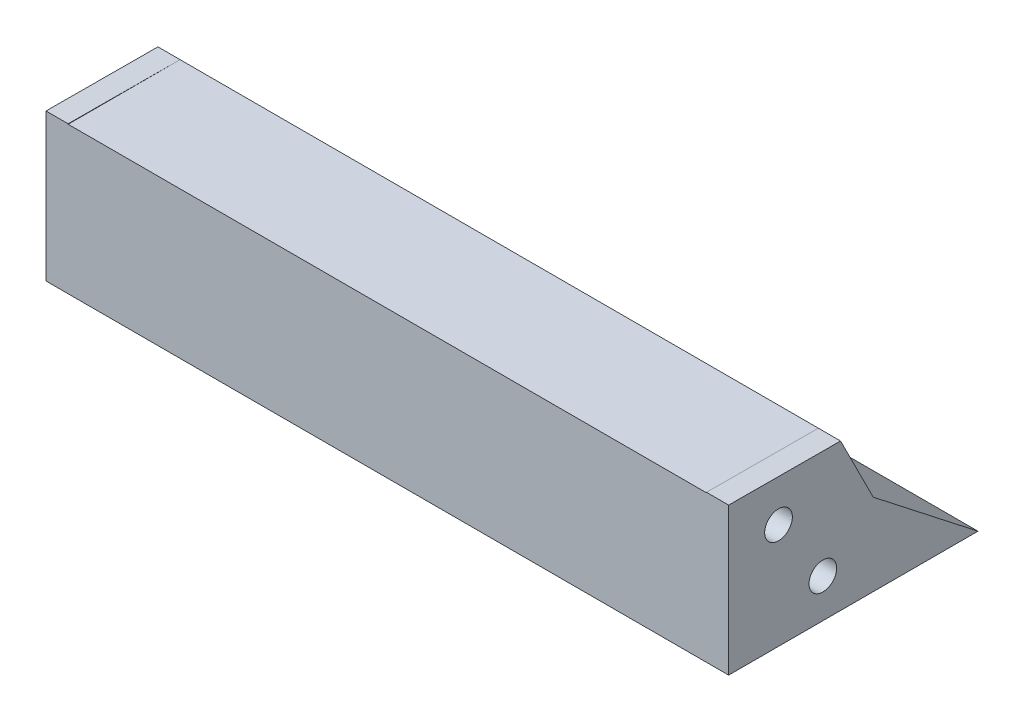
from build123d import *

# Parameters (mm, degrees)
SKETCH1_R               = 2.15
BOSS_EXTRUDE1_DEPTH     = 31.3
CUT_EXTRUDE1_REACH      = 47.396
SKETCH2_W               = 57.6
SKETCH2_H               = 12
CUT_EXTRUDE3_DEPTH      = 70.302687538
CUT_EXTRUDE4_DEPTH      = 40.979432212
CUT_EXTRUDE4_DEPTH_BACK = 40.979432212
SKETCH9_W               = 62.6
SKETCH9_H               = 52.1
SKETCH9_W_2             = 61.6
SKETCH9_H_2             = 50.1
SKETCH10_R              = 1.25
CUT_EXTRUDE5_DEPTH      = 12
CUT_EXTRUDE6_START      = -12
SKETCH11_R              = 1.25
CUT_EXTRUDE6_DEPTH      = 12


with BuildPart() as part:
    # Sketch1 → Boss-Extrude1 (new, symmetric)
    with BuildSketch(Plane(origin=(0, 0, 0), x_dir=(0, 0, -1), z_dir=(1, 0, 0))):
        with BuildLine():
            Line((-4.25, 0), (-4.25, -4))
            ThreePointArc((-4.25, -4), (-4.105356672, -4.642657212), (-3.699322277, -5.161372987))
            Line((-3.699322277, -5.161372987), (-2.000677723, -6.549868444))
            ThreePointArc((-2.000677723, -6.549868444), (-1.594643328, -7.068584218), (-1.45, -7.71124143))
            Line((-1.45, -7.71124143), (-1.45, -21))
            Line((-1.45, -21), (21.05, -21))
            Line((21.05, -21), (11.593870957, -13.612062296))
            Line((11.593870957, -13.612062296), (3.79776528, 1.907741826))
            ThreePointArc((3.79776528, 1.907741826), (-0.980305452, 4.135396138), (-4.25, 0))
        make_face()
        Circle(SKETCH1_R, mode=Mode.SUBTRACT)
    extrude(amount=BOSS_EXTRUDE1_DEPTH, both=True)

    # Cut-Extrude1: up to this plane
    cut_extrude1_end = Plane(origin=(31.3, -13.612062296, -11.593870957), z_dir=(0, -0.44888042970734693, 0.8935918306619346))
    # Sketch2 → Cut-Extrude1 (cut, up to the surface)
    with BuildSketch(Plane.XY.offset(4.25), mode=Mode.PRIVATE) as cut_extrude1_sk1:
        with Locations((0, -1.75)):
            Rectangle(SKETCH2_W, SKETCH2_H)
    cut_extrude1_tool1 = split(extrude(cut_extrude1_sk1.sketch, amount=-CUT_EXTRUDE1_REACH, mode=Mode.PRIVATE), bisect_by=cut_extrude1_end, keep=Keep.BOTH, mode=Mode.PRIVATE)
    add(cut_extrude1_tool1.solids().sort_by_distance((0, -1.75, 4.25))[0], mode=Mode.SUBTRACT)

    # Sketch8 → Cut-Extrude3 (cut, through all)
    with BuildSketch(Plane(origin=(31.3, 0, 0), x_dir=(0, 0, -1), z_dir=(1, 0, 0))):
        with BuildLine():
            Line((-1.45, -7.71124143), (8.649165161, -7.75))
            Line((8.649165161, -7.75), (3.79776528, 1.907741826))
            ThreePointArc((3.79776528, 1.907741826), (-0.980305452, 4.135396138), (-4.25, 0))
            Line((-4.25, 0), (-4.25, -4))
            ThreePointArc((-4.25, -4), (-4.105356672, -4.642657212), (-3.699322277, -5.161372987))
            Line((-3.699322277, -5.161372987), (-2.000677723, -6.549868444))
            ThreePointArc((-2.000677723, -6.549868444), (-1.594643328, -7.068584218), (-1.45, -7.71124143))
        make_face()
    extrude(amount=-CUT_EXTRUDE3_DEPTH, mode=Mode.SUBTRACT)

    # Sketch9 → Cut-Extrude4 (cut, two sides: drawn at the far end of the back side and taken through both)
    with BuildSketch(Plane(origin=(0, -7.75, 0), x_dir=(1, 0, 0), z_dir=(0, 1, 0)).offset(-CUT_EXTRUDE4_DEPTH_BACK)):
        Rectangle(SKETCH9_W, SKETCH9_H)
        Rectangle(SKETCH9_W_2, SKETCH9_H_2, mode=Mode.SUBTRACT)
    extrude(amount=CUT_EXTRUDE4_DEPTH + CUT_EXTRUDE4_DEPTH_BACK, mode=Mode.SUBTRACT)

    # Sketch10 → Cut-Extrude5 (cut)
    with BuildSketch(Plane(origin=(30.8, 0, 0), x_dir=(0, 0, -1), z_dir=(1, 0, 0))):
        with Locations(Location((3.05, -11.5, 0), (0, 0, 90))):
            Circle(SKETCH10_R)
        with Locations(Location((7.05, -17.5, 0), (0, 0, 90))):
            Circle(SKETCH10_R)
    extrude(amount=-CUT_EXTRUDE5_DEPTH, mode=Mode.SUBTRACT)

    # Sketch11 → Cut-Extrude6 (cut)
    with BuildSketch(Plane.ZY.offset(30.8).offset(CUT_EXTRUDE6_START)):
        with Locations(Location((-7.05, -17.5, 0), (0, 0, 90))):
            Circle(SKETCH11_R)
        with Locations(Location((-3.05, -11.5, 0), (0, 0, 90))):
            Circle(SKETCH11_R)
    extrude(amount=CUT_EXTRUDE6_DEPTH, mode=Mode.SUBTRACT)


solid = part.part
